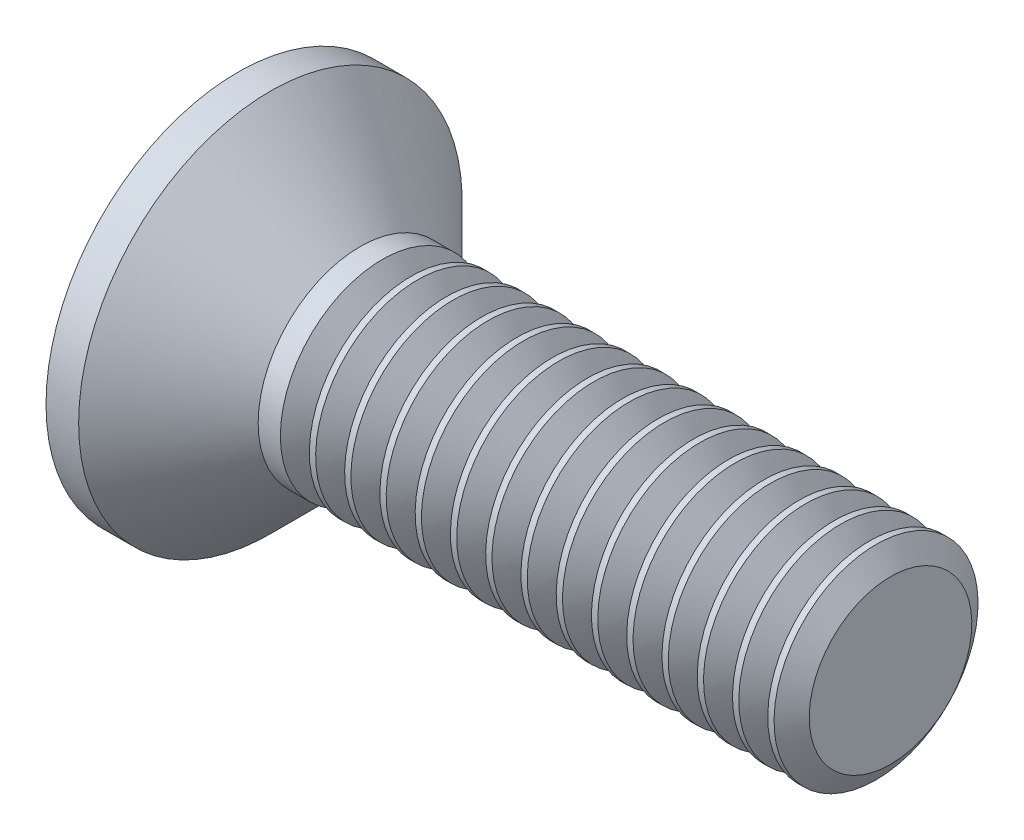
from build123d import *

# Parameters (mm, degrees)
CIRPATTERN1_COUNT = 2
CIRPATTERN1_ANGLE = 90
THDSCHPAT_COUNT   = 15
THDSCHPAT_PITCH   = 0.432142857


with BuildPart() as part:
    # BodySke → Base-Revolve (revolve)
    with BuildSketch(Plane.XY, mode=Mode.PRIVATE) as base_revolve_sk:
        Polygon((0, 0), (0, 2.35), (0.4, 2.35), (1.5, 1.25), (8, 1.25), (8, 0), align=None)
    revolve(base_revolve_sk.sketch.rotate(Axis((-6.35, 0, 0), (1, 0, 0)), 90), axis=Axis((-6.35, 0, 0), (1, 0, 0)))

    # Sketch3 → Cross section 0
    with BuildSketch(Plane.ZY):
        with BuildLine():
            Line((-0.37, 1.4), (0.37, 1.4))
            Line((0.37, 1.4), (0.37, -1.4))
            Line((0.37, -1.4), (-0.37, -1.4))
            Line((-0.37, -1.4), (-0.37, 1.4))
        make_face()
    # Sketch4 → Cross section 1
    with BuildSketch(Plane.ZY.offset(-1.78)):
        with BuildLine():
            Line((-0.185, 0.185), (0.185, 0.185))
            Line((0.185, 0.185), (0.185, -0.185))
            Line((0.185, -0.185), (-0.185, -0.185))
            Line((-0.185, -0.185), (-0.185, 0.185))
        make_face()
    cross = loft(mode=Mode.SUBTRACT)

    # CirPattern1: Cross ×2 about axis
    cirpattern1_axis = Axis((0, 0, 0), (1, 0, 0))
    for i in range(1, CIRPATTERN1_COUNT):
        add(cross.rotate(cirpattern1_axis, i * CIRPATTERN1_ANGLE / (CIRPATTERN1_COUNT - 1)), mode=Mode.SUBTRACT)

    # ThdSchSke → ThreadSchematic (revolve, cut)
    with BuildSketch(Plane.XY):
        Polygon((1.950001, -0.9965), (1.772498389, -1.25), (1.772498389, -1.5625), (2.127503611, -1.5625), (2.127503611, -1.25), align=None)
    threadschematic = revolve(axis=Axis((-3.175, 0, 0), (1, 0, 0)), mode=Mode.SUBTRACT)

    # ThdSchPat: ThreadSchematic ×15
    with Locations(*[(i * THDSCHPAT_PITCH, 0, 0) for i in range(1, THDSCHPAT_COUNT)]):
        add(threadschematic, mode=Mode.SUBTRACT)


solid = part.part
